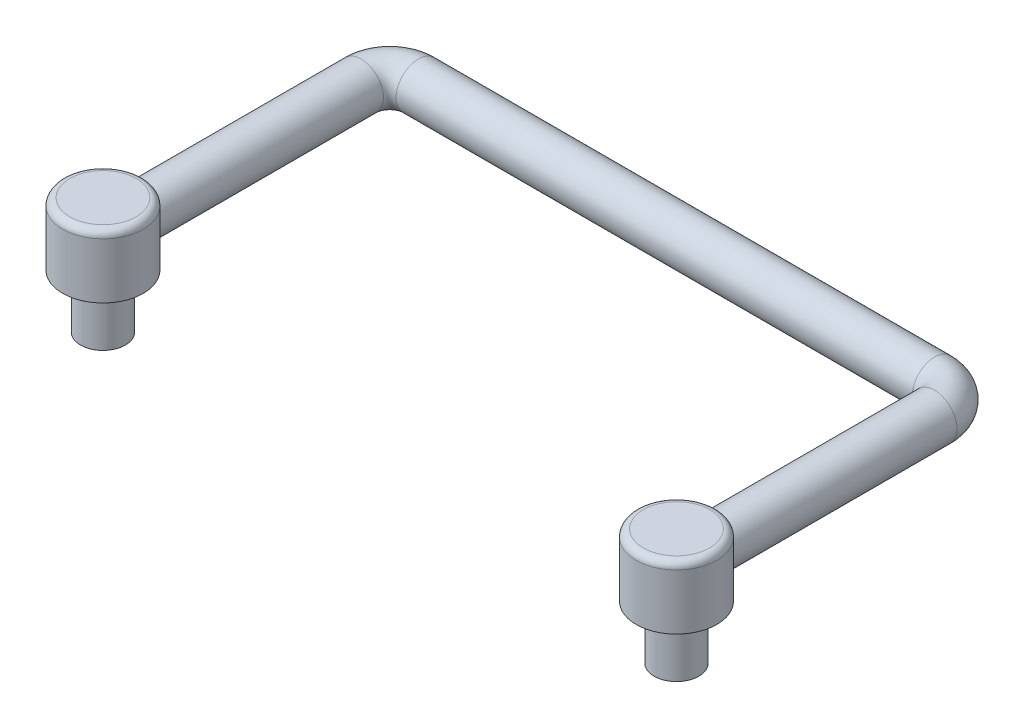
from build123d import *

# Parameters (mm, degrees)
SKETCH2_R      = 3.96875
SKETCH3_R      = 7.14375
EXTRUDE1_DEPTH = 5.55625
SKETCH4_R      = 3.96875
EXTRUDE2_DEPTH = 9.525
FILLET1_R      = 1.27


with BuildPart() as part:
    # Sweep1: sweep along a path in Sketch1
    with BuildLine(Plane(origin=(0, 0, 0), x_dir=(1, 0, 0), z_dir=(0, 1, 0))) as sweep1_path:
        Line((0, 0), (0, 45.72))
        ThreePointArc((0, 45.72), (1.487897552, 49.312102448), (5.08, 50.8))
        Line((5.08, 50.8), (96.52, 50.8))
        ThreePointArc((96.52, 50.8), (100.112102448, 49.312102448), (101.6, 45.72))
        Line((101.6, 45.72), (101.6, 0))
    # Sketch2 → Sweep1 (sweep)
    with BuildSketch(Plane.XY):
        Circle(SKETCH2_R)
    sweep(path=sweep1_path.line)

    # Sketch3 → Extrude1 (add, symmetric)
    with BuildSketch(Plane(origin=(0, 0, 0), x_dir=(1, 0, 0), z_dir=(0, 1, 0))):
        with Locations(Location((0, 0, 0), (0, 0, 270))):
            Circle(SKETCH3_R)
        with Locations(Location((101.6, 0, 0), (0, 0, 270))):
            Circle(SKETCH3_R)
    extrude(amount=EXTRUDE1_DEPTH, both=True)

    # Sketch4 → Extrude2 (add)
    with BuildSketch(Plane.XZ.offset(5.55625)):
        with Locations(Location((0, 0, 0), (0, 0, 90))):
            Circle(SKETCH4_R)
        with Locations(Location((101.6, 0, 0), (0, 0, 90))):
            Circle(SKETCH4_R)
    extrude(amount=EXTRUDE2_DEPTH)

    # Fillet1
    fillet1_edges = [part.edges().sort_by_distance(p)[0] for p in [
        (0, 5.55625, -7.14375),
        (101.6, 5.55625, -7.14375),
    ]]
    fillet(fillet1_edges, radius=FILLET1_R)


solid = part.part
